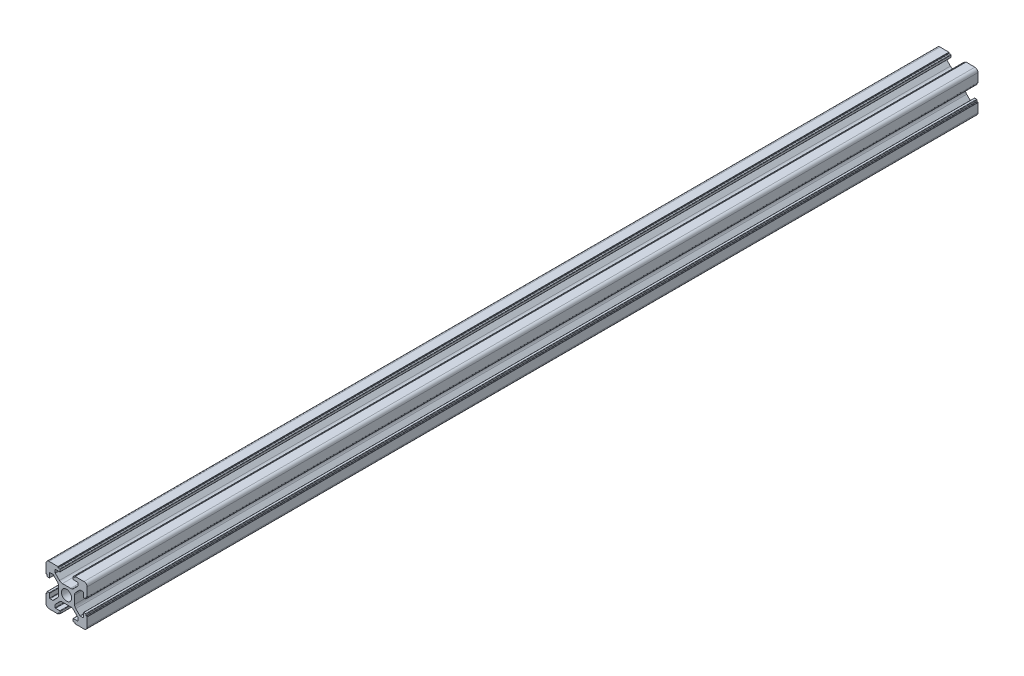
from build123d import *

# Parameters (mm, degrees)
SKETCH1_R           = 2.5
BOSS_EXTRUDE1_DEPTH = 434


with BuildPart() as part:
    # Sketch1 → Boss-Extrude1 (new body)
    with BuildSketch(Plane(origin=(0, 0, 0), x_dir=(1, 0, 0), z_dir=(0, 0, -1))):
        with BuildLine():
            Line((1.5, 0), (5.8, 0))
            ThreePointArc((5.8, 0), (5.870710678, 0.029289322), (5.9, 0.1))
            Line((5.9, 0.1), (5.9, 0.3))
            ThreePointArc((5.9, 0.3), (5.958578644, 0.441421356), (6.1, 0.5))
            Line((6.1, 0.5), (6.7, 0.5))
            ThreePointArc((6.7, 0.5), (6.841421356, 0.558578644), (6.9, 0.7))
            Line((6.9, 0.7), (6.9, 1.6))
            ThreePointArc((6.9, 1.6), (6.841421356, 1.741421356), (6.7, 1.8))
            Line((6.7, 1.8), (4.7, 1.8))
            ThreePointArc((4.7, 1.8), (4.558578644, 1.858578644), (4.5, 2))
            Line((4.5, 2), (4.5, 3.31507576))
            ThreePointArc((4.5, 3.31507576), (4.52283614, 3.429880789), (4.587867966, 3.527207794))
            Line((4.587867966, 3.527207794), (6.574873734, 5.514213562))
            ThreePointArc((6.574873734, 5.514213562), (7.223720432, 5.947759065), (7.989087297, 6.1))
            Line((7.989087297, 6.1), (12.010912703, 6.1))
            ThreePointArc((12.010912703, 6.1), (12.776279568, 5.947759065), (13.425126266, 5.514213562))
            Line((13.425126266, 5.514213562), (15.412132034, 3.527207794))
            ThreePointArc((15.412132034, 3.527207794), (15.47716386, 3.429880789), (15.5, 3.31507576))
            Line((15.5, 3.31507576), (15.5, 2))
            ThreePointArc((15.5, 2), (15.441421356, 1.858578644), (15.3, 1.8))
            Line((15.3, 1.8), (13.3, 1.8))
            ThreePointArc((13.3, 1.8), (13.158578644, 1.741421356), (13.1, 1.6))
            Line((13.1, 1.6), (13.1, 0.7))
            ThreePointArc((13.1, 0.7), (13.158578644, 0.558578644), (13.3, 0.5))
            Line((13.3, 0.5), (13.9, 0.5))
            ThreePointArc((13.9, 0.5), (14.041421356, 0.441421356), (14.1, 0.3))
            Line((14.1, 0.3), (14.1, 0.1))
            ThreePointArc((14.1, 0.1), (14.129289322, 0.029289322), (14.2, 0))
            Line((14.2, 0), (18.5, 0))
            ThreePointArc((18.5, 0), (19.560660172, 0.439339828), (20, 1.5))
            Line((20, 1.5), (20, 5.8))
            ThreePointArc((20, 5.8), (19.970710678, 5.870710678), (19.9, 5.9))
            Line((19.9, 5.9), (19.7, 5.9))
            ThreePointArc((19.7, 5.9), (19.558578644, 5.958578644), (19.5, 6.1))
            Line((19.5, 6.1), (19.5, 6.7))
            ThreePointArc((19.5, 6.7), (19.441421356, 6.841421356), (19.3, 6.9))
            Line((19.3, 6.9), (18.4, 6.9))
            ThreePointArc((18.4, 6.9), (18.258578644, 6.841421356), (18.2, 6.7))
            Line((18.2, 6.7), (18.2, 4.7))
            ThreePointArc((18.2, 4.7), (18.141421356, 4.558578644), (18, 4.5))
            Line((18, 4.5), (16.68492424, 4.5))
            ThreePointArc((16.68492424, 4.5), (16.570119211, 4.52283614), (16.472792206, 4.587867966))
            Line((16.472792206, 4.587867966), (14.485786438, 6.574873734))
            ThreePointArc((14.485786438, 6.574873734), (14.052240935, 7.223720432), (13.9, 7.989087297))
            Line((13.9, 7.989087297), (13.9, 12.010912703))
            ThreePointArc((13.9, 12.010912703), (14.052240935, 12.776279568), (14.485786438, 13.425126266))
            Line((14.485786438, 13.425126266), (16.472792206, 15.412132034))
            ThreePointArc((16.472792206, 15.412132034), (16.570119211, 15.47716386), (16.68492424, 15.5))
            Line((16.68492424, 15.5), (18, 15.5))
            ThreePointArc((18, 15.5), (18.141421356, 15.441421356), (18.2, 15.3))
            Line((18.2, 15.3), (18.2, 13.3))
            ThreePointArc((18.2, 13.3), (18.258578644, 13.158578644), (18.4, 13.1))
            Line((18.4, 13.1), (19.3, 13.1))
            ThreePointArc((19.3, 13.1), (19.441421356, 13.158578644), (19.5, 13.3))
            Line((19.5, 13.3), (19.5, 13.9))
            ThreePointArc((19.5, 13.9), (19.558578644, 14.041421356), (19.7, 14.1))
            Line((19.7, 14.1), (19.9, 14.1))
            ThreePointArc((19.9, 14.1), (19.970710678, 14.129289322), (20, 14.2))
            Line((20, 14.2), (20, 18.5))
            ThreePointArc((20, 18.5), (19.560660172, 19.560660172), (18.5, 20))
            Line((18.5, 20), (14.2, 20))
            ThreePointArc((14.2, 20), (14.129289322, 19.970710678), (14.1, 19.9))
            Line((14.1, 19.9), (14.1, 19.7))
            ThreePointArc((14.1, 19.7), (14.041421356, 19.558578644), (13.9, 19.5))
            Line((13.9, 19.5), (13.3, 19.5))
            ThreePointArc((13.3, 19.5), (13.158578644, 19.441421356), (13.1, 19.3))
            Line((13.1, 19.3), (13.1, 18.4))
            ThreePointArc((13.1, 18.4), (13.158578644, 18.258578644), (13.3, 18.2))
            Line((13.3, 18.2), (15.3, 18.2))
            ThreePointArc((15.3, 18.2), (15.441421356, 18.141421356), (15.5, 18))
            Line((15.5, 18), (15.5, 16.68492424))
            ThreePointArc((15.5, 16.68492424), (15.47716386, 16.570119211), (15.412132034, 16.472792206))
            Line((15.412132034, 16.472792206), (13.425126266, 14.485786438))
            ThreePointArc((13.425126266, 14.485786438), (12.776279568, 14.052240935), (12.010912703, 13.9))
            Line((12.010912703, 13.9), (7.989087297, 13.9))
            ThreePointArc((7.989087297, 13.9), (7.223720432, 14.052240935), (6.574873734, 14.485786438))
            Line((6.574873734, 14.485786438), (4.587867966, 16.472792206))
            ThreePointArc((4.587867966, 16.472792206), (4.52283614, 16.570119211), (4.5, 16.68492424))
            Line((4.5, 16.68492424), (4.5, 18))
            ThreePointArc((4.5, 18), (4.558578644, 18.141421356), (4.7, 18.2))
            Line((4.7, 18.2), (6.7, 18.2))
            ThreePointArc((6.7, 18.2), (6.841421356, 18.258578644), (6.9, 18.4))
            Line((6.9, 18.4), (6.9, 19.3))
            ThreePointArc((6.9, 19.3), (6.841421356, 19.441421356), (6.7, 19.5))
            Line((6.7, 19.5), (6.1, 19.5))
            ThreePointArc((6.1, 19.5), (5.958578644, 19.558578644), (5.9, 19.7))
            Line((5.9, 19.7), (5.9, 19.9))
            ThreePointArc((5.9, 19.9), (5.870710678, 19.970710678), (5.8, 20))
            Line((5.8, 20), (1.5, 20))
            ThreePointArc((1.5, 20), (0.439339828, 19.560660172), (0, 18.5))
            Line((0, 18.5), (0, 14.2))
            ThreePointArc((0, 14.2), (0.029289322, 14.129289322), (0.1, 14.1))
            Line((0.1, 14.1), (0.3, 14.1))
            ThreePointArc((0.3, 14.1), (0.441421356, 14.041421356), (0.5, 13.9))
            Line((0.5, 13.9), (0.5, 13.3))
            ThreePointArc((0.5, 13.3), (0.558578644, 13.158578644), (0.7, 13.1))
            Line((0.7, 13.1), (1.6, 13.1))
            ThreePointArc((1.6, 13.1), (1.741421356, 13.158578644), (1.8, 13.3))
            Line((1.8, 13.3), (1.8, 15.3))
            ThreePointArc((1.8, 15.3), (1.858578644, 15.441421356), (2, 15.5))
            Line((2, 15.5), (3.31507576, 15.5))
            ThreePointArc((3.31507576, 15.5), (3.429880789, 15.47716386), (3.527207794, 15.412132034))
            Line((3.527207794, 15.412132034), (5.514213562, 13.425126266))
            ThreePointArc((5.514213562, 13.425126266), (5.947759065, 12.776279568), (6.1, 12.010912703))
            Line((6.1, 12.010912703), (6.1, 7.989087297))
            ThreePointArc((6.1, 7.989087297), (5.947759065, 7.223720432), (5.514213562, 6.574873734))
            Line((5.514213562, 6.574873734), (3.527207794, 4.587867966))
            ThreePointArc((3.527207794, 4.587867966), (3.429880789, 4.52283614), (3.31507576, 4.5))
            Line((3.31507576, 4.5), (2, 4.5))
            ThreePointArc((2, 4.5), (1.858578644, 4.558578644), (1.8, 4.7))
            Line((1.8, 4.7), (1.8, 6.7))
            ThreePointArc((1.8, 6.7), (1.741421356, 6.841421356), (1.6, 6.9))
            Line((1.6, 6.9), (0.7, 6.9))
            ThreePointArc((0.7, 6.9), (0.558578644, 6.841421356), (0.5, 6.7))
            Line((0.5, 6.7), (0.5, 6.1))
            ThreePointArc((0.5, 6.1), (0.441421356, 5.958578644), (0.3, 5.9))
            Line((0.3, 5.9), (0.1, 5.9))
            ThreePointArc((0.1, 5.9), (0.029289322, 5.870710678), (0, 5.8))
            Line((0, 5.8), (0, 1.5))
            ThreePointArc((0, 1.5), (0.439339828, 0.439339828), (1.5, 0))
        make_face()
        with Locations(Location((10, 10, 0), (0, 0, 180))):
            Circle(SKETCH1_R, mode=Mode.SUBTRACT)
    extrude(amount=BOSS_EXTRUDE1_DEPTH)


solid = part.part
